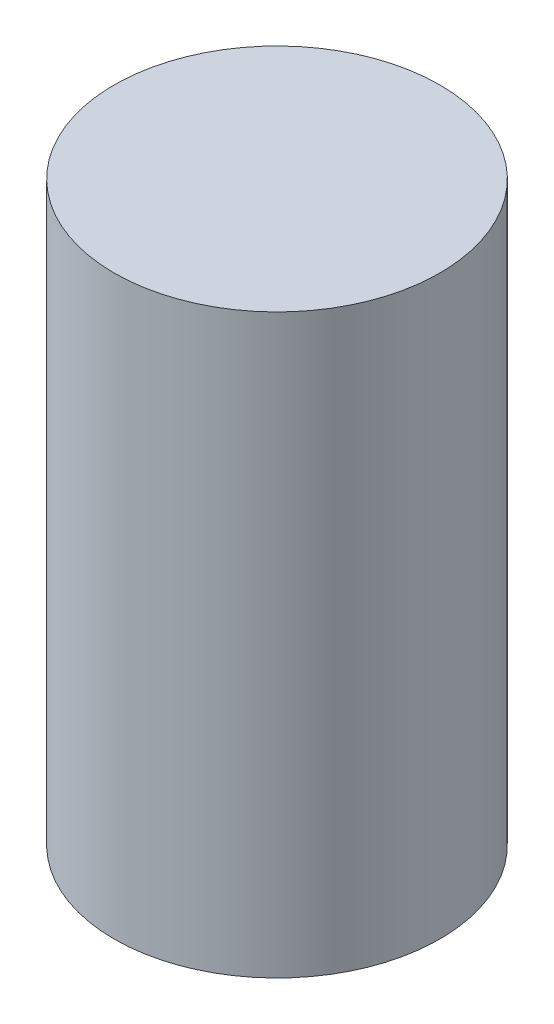
from build123d import *

# Parameters (mm, degrees)
SKETCH_1_R            = 19.625
EXTRUDE_1_DEPTH       = 69.5
HOLE_WIZARD_M51_D     = 4.2
HOLE_WIZARD_M51_DEPTH = 14
HOLE_WIZARD_M51_TIP   = 1.2618073


with BuildPart() as part:
    # Эскиз1 → Бобышка-Вытянуть1 (new body)
    with BuildSketch(Plane(origin=(0, 0, 0), x_dir=(1, 0, 0), z_dir=(0, 1, 0))):
        with Locations(Location((0, 0, 0), (0, 0, 270))):
            Circle(SKETCH_1_R)
    extrude(amount=EXTRUDE_1_DEPTH)

    # Отверстие обработанное метчиком M51
    with Locations(Plane(origin=(0, 0, 0), x_dir=(-1, 0, 0), z_dir=(0, -1, 0))):
        with Locations((0, 0)):
            Hole(HOLE_WIZARD_M51_D / 2, depth=HOLE_WIZARD_M51_DEPTH)
            with Locations((0, 0, -(HOLE_WIZARD_M51_DEPTH + HOLE_WIZARD_M51_TIP / 2))):  # 118° drill point
                Cone(0, HOLE_WIZARD_M51_D / 2, HOLE_WIZARD_M51_TIP, mode=Mode.SUBTRACT)


solid = part.part
